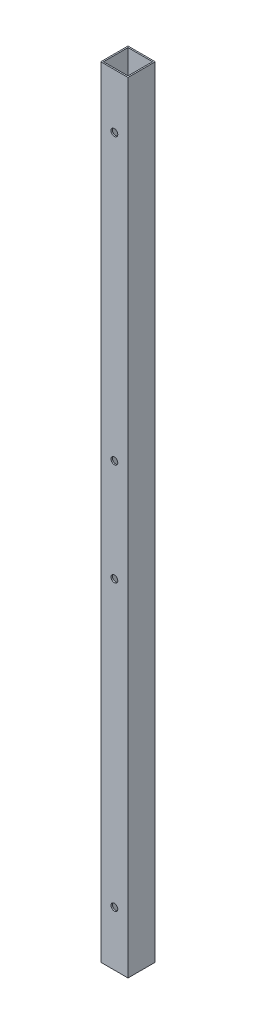
from build123d import *

# Parameters (mm, degrees)
SKETCH2_W                 = 50.8
SKETCH2_H                 = 50.8
SKETCH2_W_2               = 45.72
SKETCH2_H_2               = 45.72
BOSS_EXTRUDE2_DEPTH       = 1454.15
F_97_0_5_DIAMETER_HOLE1_D = 12.7
F_97_0_5_DIAMETER_HOLE2_D = 12.7


with BuildPart() as part:
    # Sketch2 → Boss-Extrude2 (new body)
    with BuildSketch(Plane(origin=(0, 0, 0), x_dir=(1, 0, 0), z_dir=(0, 1, 0))):
        Rectangle(SKETCH2_W, SKETCH2_H)
        Rectangle(SKETCH2_W_2, SKETCH2_H_2, mode=Mode.SUBTRACT)
    extrude(amount=BOSS_EXTRUDE2_DEPTH)

    # #97 (0.5) Diameter Hole1 (through all)
    with Locations(Plane(origin=(0, 1352.55, 25.4), x_dir=(1, 0, 0), z_dir=(0, 0, 1))):
        with Locations((0, 0), (0, -1250.95)):
            Hole(F_97_0_5_DIAMETER_HOLE1_D / 2)

    # #97 (0.5) Diameter Hole2 (through all)
    with Locations(Plane(origin=(0, 822.325, 25.4), x_dir=(1, 0, 0), z_dir=(0, 0, 1))):
        with Locations((0, 0), (0, -190.5)):
            Hole(F_97_0_5_DIAMETER_HOLE2_D / 2)


solid = part.part
